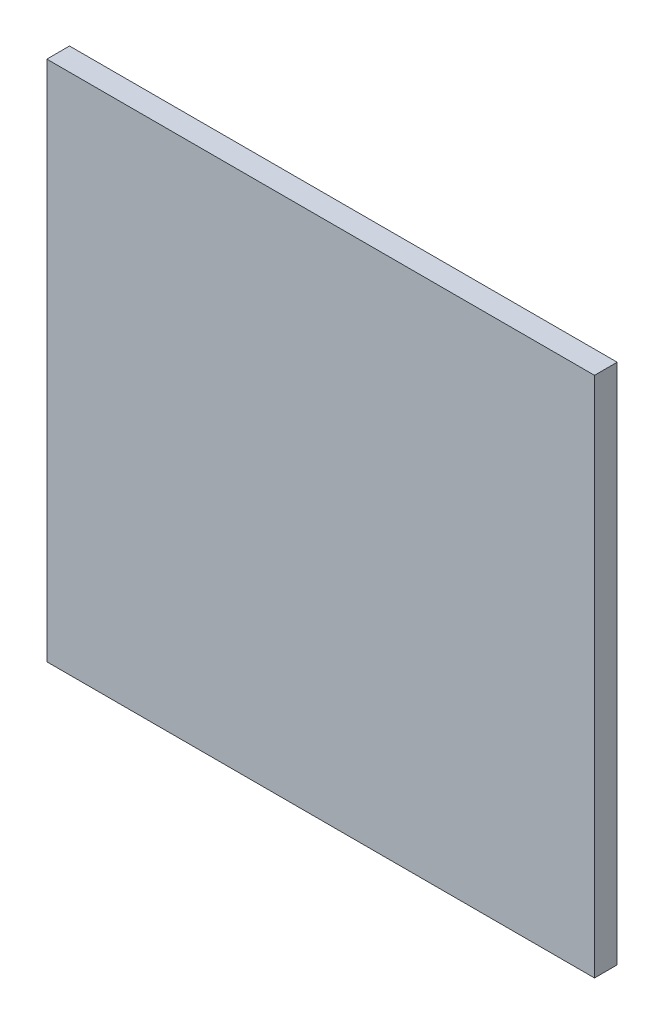
from build123d import *

# Parameters (mm, degrees)
SKETCH_1_W      = 36.2
SKETCH_1_H      = 34.5
EXTRUDE_1_DEPTH = 1.5


with BuildPart() as part:
    # 草图1 → 凸台-拉伸1 (new body)
    with BuildSketch(Plane.XY):
        Rectangle(SKETCH_1_W, SKETCH_1_H)
    extrude(amount=EXTRUDE_1_DEPTH)


solid = part.part
